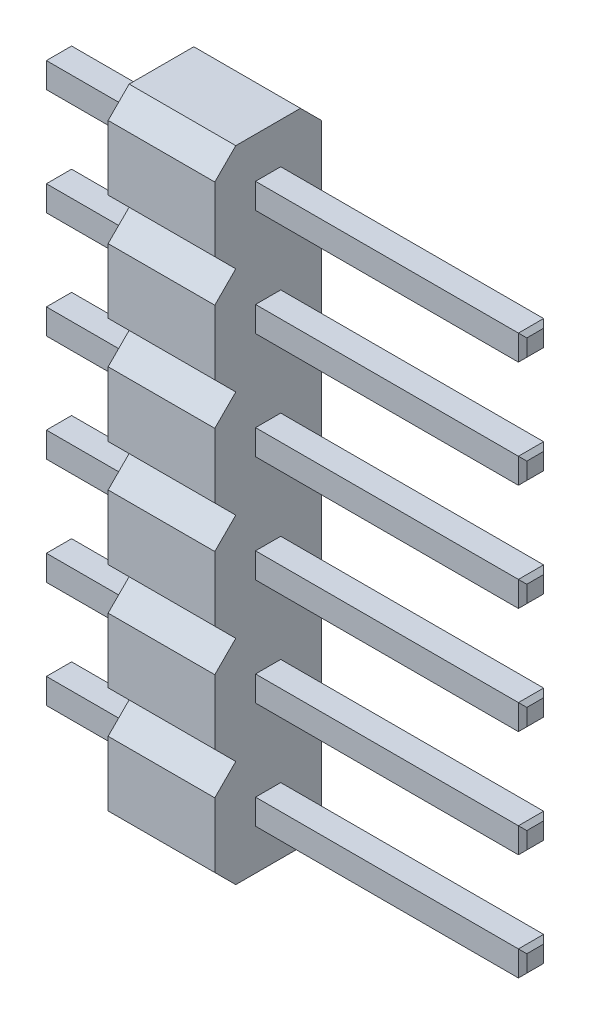
from build123d import *

# Parameters (mm, degrees)
PLASTIC_DEPTH   = 2.54
SKETCH2_W       = 11.44
SKETCH2_H       = 0.6
CONTACT_DEPTH   = 0.3
CHAMFER1_SIZE   = 0.1
LPATTERN1_COUNT = 6
LPATTERN1_PITCH = 2.54


with BuildPart() as part:
    # Sketch1 → Plastic (new body)
    with BuildSketch(Plane(origin=(0, 0, 0), x_dir=(0, 0, -1), z_dir=(1, 0, 0))):
        Polygon((-2.04, 1.27), (-0.5, 1.27), (0, 0.77), (0, -0.77), (-0.5, -1.27), (-2.04, -1.27), (-2.54, -0.77), (-2.54, 0.77), align=None)
    extrude(amount=PLASTIC_DEPTH)

    # Sketch2 → Contact (add, symmetric)
    with BuildSketch(Plane(origin=(0, 0, 0), x_dir=(1, 0, 0), z_dir=(0, 1, 0))):
        with Locations((3.18, -1.27)):
            Rectangle(SKETCH2_W, SKETCH2_H)
    extrude(amount=CONTACT_DEPTH, both=True)

    # Chamfer1
    chamfer1_edges = [part.edges().sort_by_distance(p)[0] for p in [
        (8.9, 0.3, 1.27),
        (8.9, 0, 1.57),
        (8.9, -0.3, 1.27),
        (8.9, 0, 0.97),
        (-2.54, -0.3, 1.27),
        (-2.54, 0, 0.97),
        (-2.54, 0.3, 1.27),
        (-2.54, 0, 1.57),
    ]]
    chamfer(chamfer1_edges, length=CHAMFER1_SIZE)

    # LPattern1: part ×6


with BuildPart() as part_1:
    add(part.part)
    with Locations(*[(0, i * LPATTERN1_PITCH, 0) for i in range(1, LPATTERN1_COUNT)]):
        add(part.part)


solid = part_1.part
